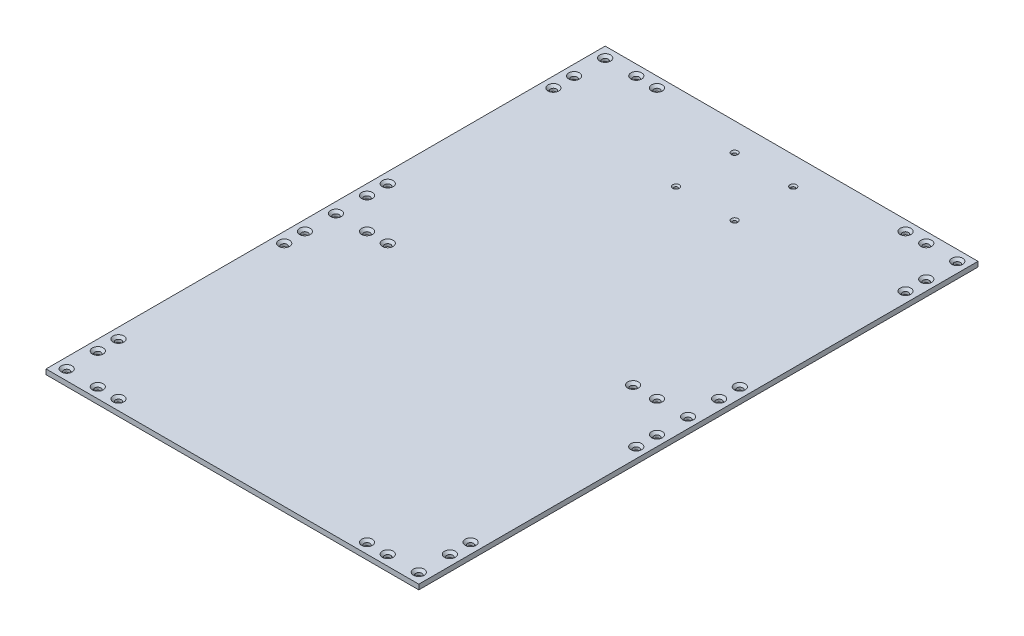
from build123d import *

# Parameters (mm, degrees)
SKETCH1_W                                       = 360
SKETCH1_H                                       = 540
BOSS_EXTRUDE1_DEPTH                             = 4.826
CSK_FOR_M3_FLAT_HEAD_MACHINE_SCREW1_D           = 3.6
CSK_FOR_M3_FLAT_HEAD_MACHINE_SCREW1_CSINK_D     = 6.3
CSK_FOR_M3_FLAT_HEAD_MACHINE_SCREW1_CSINK_ANGLE = 90
CSK_FOR_M5_FLAT_HEAD_MACHINE_SCREW1_AT_2_COUNT  = 2
CSK_FOR_M5_FLAT_HEAD_MACHINE_SCREW1_AT_2_PITCH  = 231.948270095
CSK_FOR_M5_FLAT_HEAD_MACHINE_SCREW1_AT_3_COUNT  = 2
CSK_FOR_M5_FLAT_HEAD_MACHINE_SCREW1_AT_3_PITCH  = 230
CSK_FOR_M5_FLAT_HEAD_MACHINE_SCREW1_AT_4_COUNT  = 2
CSK_FOR_M5_FLAT_HEAD_MACHINE_SCREW1_AT_4_PITCH  = 280
CSK_FOR_M5_FLAT_HEAD_MACHINE_SCREW1_AT_5_COUNT  = 2
CSK_FOR_M5_FLAT_HEAD_MACHINE_SCREW1_AT_5_PITCH  = 42.426406871
CSK_FOR_M5_FLAT_HEAD_MACHINE_SCREW1_AT_6_COUNT  = 2
CSK_FOR_M5_FLAT_HEAD_MACHINE_SCREW1_AT_6_PITCH  = 30
CSK_FOR_M5_FLAT_HEAD_MACHINE_SCREW1_AT_7_COUNT  = 2
CSK_FOR_M5_FLAT_HEAD_MACHINE_SCREW1_AT_7_PITCH  = 311.448230048
CSK_FOR_M5_FLAT_HEAD_MACHINE_SCREW1_AT_8_COUNT  = 2
CSK_FOR_M5_FLAT_HEAD_MACHINE_SCREW1_AT_8_PITCH  = 341.320963318
CSK_FOR_M5_FLAT_HEAD_MACHINE_SCREW1_AT_9_COUNT  = 2
CSK_FOR_M5_FLAT_HEAD_MACHINE_SCREW1_AT_9_PITCH  = 340
CSK_FOR_M5_FLAT_HEAD_MACHINE_SCREW1_AT_1_COUNT  = 2
CSK_FOR_M5_FLAT_HEAD_MACHINE_SCREW1_AT_1_PITCH  = 200
CSK_FOR_M5_FLAT_HEAD_MACHINE_SCREW1_2_COUNT     = 2
CSK_FOR_M5_FLAT_HEAD_MACHINE_SCREW1_2_PITCH     = 410.487515035
CSK_FOR_M5_FLAT_HEAD_MACHINE_SCREW1_3_COUNT     = 2
CSK_FOR_M5_FLAT_HEAD_MACHINE_SCREW1_3_PITCH     = 260
CSK_FOR_M5_FLAT_HEAD_MACHINE_SCREW1_4_COUNT     = 2
CSK_FOR_M5_FLAT_HEAD_MACHINE_SCREW1_4_PITCH     = 386.005181312
CSK_FOR_M5_FLAT_HEAD_MACHINE_SCREW1_5_COUNT     = 2
CSK_FOR_M5_FLAT_HEAD_MACHINE_SCREW1_5_PITCH     = 572.013985843
CSK_FOR_M5_FLAT_HEAD_MACHINE_SCREW1_6_COUNT     = 2
CSK_FOR_M5_FLAT_HEAD_MACHINE_SCREW1_6_PITCH     = 596.40590205
CSK_FOR_M5_FLAT_HEAD_MACHINE_SCREW1_7_COUNT     = 2
CSK_FOR_M5_FLAT_HEAD_MACHINE_SCREW1_7_PITCH     = 579.827560573
CSK_FOR_M5_FLAT_HEAD_MACHINE_SCREW1_8_COUNT     = 2
CSK_FOR_M5_FLAT_HEAD_MACHINE_SCREW1_8_PITCH     = 490.917508345
CSK_FOR_M5_FLAT_HEAD_MACHINE_SCREW1_9_COUNT     = 2
CSK_FOR_M5_FLAT_HEAD_MACHINE_SCREW1_9_PITCH     = 490
CSK_FOR_M5_FLAT_HEAD_MACHINE_SCREW1_10_COUNT    = 2
CSK_FOR_M5_FLAT_HEAD_MACHINE_SCREW1_10_PITCH    = 460
CSK_FOR_M5_FLAT_HEAD_MACHINE_SCREW1_11_COUNT    = 2
CSK_FOR_M5_FLAT_HEAD_MACHINE_SCREW1_11_PITCH    = 235.372045919
CSK_FOR_M5_FLAT_HEAD_MACHINE_SCREW1_12_COUNT    = 2
CSK_FOR_M5_FLAT_HEAD_MACHINE_SCREW1_12_PITCH    = 180
CSK_FOR_M5_FLAT_HEAD_MACHINE_SCREW1_13_COUNT    = 2
CSK_FOR_M5_FLAT_HEAD_MACHINE_SCREW1_13_PITCH    = 440
CSK_FOR_M5_FLAT_HEAD_MACHINE_SCREW1_14_COUNT    = 2
CSK_FOR_M5_FLAT_HEAD_MACHINE_SCREW1_14_PITCH    = 492.544414241
CSK_FOR_M5_FLAT_HEAD_MACHINE_SCREW1_15_COUNT    = 2
CSK_FOR_M5_FLAT_HEAD_MACHINE_SCREW1_15_PITCH    = 569.385633819
CSK_FOR_M5_FLAT_HEAD_MACHINE_SCREW1_16_COUNT    = 2
CSK_FOR_M5_FLAT_HEAD_MACHINE_SCREW1_16_PITCH    = 556.057550978
CSK_FOR_M5_FLAT_HEAD_MACHINE_SCREW1_17_COUNT    = 2
CSK_FOR_M5_FLAT_HEAD_MACHINE_SCREW1_17_PITCH    = 440.454310911
CSK_FOR_M5_FLAT_HEAD_MACHINE_SCREW1_18_COUNT    = 2
CSK_FOR_M5_FLAT_HEAD_MACHINE_SCREW1_18_PITCH    = 428.018691181
CSK_FOR_M5_FLAT_HEAD_MACHINE_SCREW1_19_COUNT    = 2
CSK_FOR_M5_FLAT_HEAD_MACHINE_SCREW1_19_PITCH    = 367.730729503
CSK_FOR_M5_FLAT_HEAD_MACHINE_SCREW1_20_COUNT    = 2
CSK_FOR_M5_FLAT_HEAD_MACHINE_SCREW1_20_PITCH    = 394.461658466
CSK_FOR_M5_FLAT_HEAD_MACHINE_SCREW1_21_COUNT    = 2
CSK_FOR_M5_FLAT_HEAD_MACHINE_SCREW1_21_PITCH    = 384.707681233
CSK_FOR_M5_FLAT_HEAD_MACHINE_SCREW1_22_COUNT    = 2
CSK_FOR_M5_FLAT_HEAD_MACHINE_SCREW1_22_PITCH    = 340.587727319
CSK_FOR_M5_FLAT_HEAD_MACHINE_SCREW1_23_COUNT    = 2
CSK_FOR_M5_FLAT_HEAD_MACHINE_SCREW1_23_PITCH    = 291.547594742
CSK_FOR_M5_FLAT_HEAD_MACHINE_SCREW1_24_COUNT    = 2
CSK_FOR_M5_FLAT_HEAD_MACHINE_SCREW1_24_PITCH    = 20
CSK_FOR_M5_FLAT_HEAD_MACHINE_SCREW1_25_COUNT    = 2
CSK_FOR_M5_FLAT_HEAD_MACHINE_SCREW1_25_PITCH    = 58.309518948


with BuildPart() as part:
    # Sketch1 → Boss-Extrude1 (new body)
    with BuildSketch(Plane(origin=(0, 0, 0), x_dir=(1, 0, 0), z_dir=(0, 1, 0))):
        with Locations((180, -270)):
            Rectangle(SKETCH1_W, SKETCH1_H)
    extrude(amount=BOSS_EXTRUDE1_DEPTH)

    # CSK for M3 Flat Head Machine Screw1 (through all)
    with Locations(Plane(origin=(0, 4.826, 0), x_dir=(1, 0, 0), z_dir=(0, 1, 0))):
        with Locations((151.715728753, -26.715728753), (208.284271247, -26.715728753), (208.284271247, -83.284271247), (151.715728753, -83.284271247)):
            CounterSinkHole(CSK_FOR_M3_FLAT_HEAD_MACHINE_SCREW1_D / 2, CSK_FOR_M3_FLAT_HEAD_MACHINE_SCREW1_CSINK_D / 2, counter_sink_angle=CSK_FOR_M3_FLAT_HEAD_MACHINE_SCREW1_CSINK_ANGLE)

    # Sketch15 → CSK for M5 Flat Head Machine Screw1 (revolve, cut)
    with BuildSketch(Plane(origin=(10, 4.826, 500), x_dir=(0, 0, 1), z_dir=(1, 0, 0))):
        Polygon((0, 0), (0, 4.826), (2.9, 4.826), (2.9, 2.3), (5.2, 0), align=None)
    csk_for_m5_flat_head_machine_screw1 = revolve(axis=Axis((10, 11.176, 500), (0, -1, 0)), mode=Mode.SUBTRACT)

    # CSK for M5 Flat Head Machine Screw1 at 2: CSK for M5 Flat Head Machine Screw1 ×2
    with Locations(*[Vector(0.12933918406776812, 0, -0.9916004111862218) * (i * CSK_FOR_M5_FLAT_HEAD_MACHINE_SCREW1_AT_2_PITCH) for i in range(1, CSK_FOR_M5_FLAT_HEAD_MACHINE_SCREW1_AT_2_COUNT)]):
        add(csk_for_m5_flat_head_machine_screw1, mode=Mode.SUBTRACT)

    # CSK for M5 Flat Head Machine Screw1 at 3: CSK for M5 Flat Head Machine Screw1 ×2
    with Locations(*[(0, 0, -i * CSK_FOR_M5_FLAT_HEAD_MACHINE_SCREW1_AT_3_PITCH) for i in range(1, CSK_FOR_M5_FLAT_HEAD_MACHINE_SCREW1_AT_3_COUNT)]):
        add(csk_for_m5_flat_head_machine_screw1, mode=Mode.SUBTRACT)

    # CSK for M5 Flat Head Machine Screw1 at 4: CSK for M5 Flat Head Machine Screw1 ×2
    with Locations(*[(0, 0, -i * CSK_FOR_M5_FLAT_HEAD_MACHINE_SCREW1_AT_4_PITCH) for i in range(1, CSK_FOR_M5_FLAT_HEAD_MACHINE_SCREW1_AT_4_COUNT)]):
        add(csk_for_m5_flat_head_machine_screw1, mode=Mode.SUBTRACT)

    # CSK for M5 Flat Head Machine Screw1 at 5: CSK for M5 Flat Head Machine Screw1 ×2
    with Locations(*[Vector(0.7071067811865471, 0, 0.707106781186548) * (i * CSK_FOR_M5_FLAT_HEAD_MACHINE_SCREW1_AT_5_PITCH) for i in range(1, CSK_FOR_M5_FLAT_HEAD_MACHINE_SCREW1_AT_5_COUNT)]):
        add(csk_for_m5_flat_head_machine_screw1, mode=Mode.SUBTRACT)

    # CSK for M5 Flat Head Machine Screw1 at 6: CSK for M5 Flat Head Machine Screw1 ×2
    with Locations(*[(0, 0, i * CSK_FOR_M5_FLAT_HEAD_MACHINE_SCREW1_AT_6_PITCH) for i in range(1, CSK_FOR_M5_FLAT_HEAD_MACHINE_SCREW1_AT_6_COUNT)]):
        add(csk_for_m5_flat_head_machine_screw1, mode=Mode.SUBTRACT)

    # CSK for M5 Flat Head Machine Screw1 at 7: CSK for M5 Flat Head Machine Screw1 ×2
    with Locations(*[Vector(0.9953500135553002, 0, 0.09632419486019031) * (i * CSK_FOR_M5_FLAT_HEAD_MACHINE_SCREW1_AT_7_PITCH) for i in range(1, CSK_FOR_M5_FLAT_HEAD_MACHINE_SCREW1_AT_7_COUNT)]):
        add(csk_for_m5_flat_head_machine_screw1, mode=Mode.SUBTRACT)

    # CSK for M5 Flat Head Machine Screw1 at 8: CSK for M5 Flat Head Machine Screw1 ×2
    with Locations(*[Vector(0.996129850025381, 0, 0.08789381029635711) * (i * CSK_FOR_M5_FLAT_HEAD_MACHINE_SCREW1_AT_8_PITCH) for i in range(1, CSK_FOR_M5_FLAT_HEAD_MACHINE_SCREW1_AT_8_COUNT)]):
        add(csk_for_m5_flat_head_machine_screw1, mode=Mode.SUBTRACT)

    # CSK for M5 Flat Head Machine Screw1 at 9: CSK for M5 Flat Head Machine Screw1 ×2
    with Locations(*[(i * CSK_FOR_M5_FLAT_HEAD_MACHINE_SCREW1_AT_9_PITCH, 0, 0) for i in range(1, CSK_FOR_M5_FLAT_HEAD_MACHINE_SCREW1_AT_9_COUNT)]):
        add(csk_for_m5_flat_head_machine_screw1, mode=Mode.SUBTRACT)

    # CSK for M5 Flat Head Machine Screw1 at 1: CSK for M5 Flat Head Machine Screw1 ×2
    with Locations(*[(0, 0, -i * CSK_FOR_M5_FLAT_HEAD_MACHINE_SCREW1_AT_1_PITCH) for i in range(1, CSK_FOR_M5_FLAT_HEAD_MACHINE_SCREW1_AT_1_COUNT)]):
        add(csk_for_m5_flat_head_machine_screw1, mode=Mode.SUBTRACT)

    # CSK for M5 Flat Head Machine Screw1  2: CSK for M5 Flat Head Machine Screw1 ×2
    with Locations(*[Vector(0.828283413127963, 0, -0.5603093677042105) * (i * CSK_FOR_M5_FLAT_HEAD_MACHINE_SCREW1_2_PITCH) for i in range(1, CSK_FOR_M5_FLAT_HEAD_MACHINE_SCREW1_2_COUNT)]):
        add(csk_for_m5_flat_head_machine_screw1, mode=Mode.SUBTRACT)

    # CSK for M5 Flat Head Machine Screw1  3: CSK for M5 Flat Head Machine Screw1 ×2
    with Locations(*[(0, 0, -i * CSK_FOR_M5_FLAT_HEAD_MACHINE_SCREW1_3_PITCH) for i in range(1, CSK_FOR_M5_FLAT_HEAD_MACHINE_SCREW1_3_COUNT)]):
        add(csk_for_m5_flat_head_machine_screw1, mode=Mode.SUBTRACT)

    # CSK for M5 Flat Head Machine Screw1  4: CSK for M5 Flat Head Machine Screw1 ×2
    with Locations(*[Vector(0.8030980282338016, 0, -0.5958469241734659) * (i * CSK_FOR_M5_FLAT_HEAD_MACHINE_SCREW1_4_PITCH) for i in range(1, CSK_FOR_M5_FLAT_HEAD_MACHINE_SCREW1_4_COUNT)]):
        add(csk_for_m5_flat_head_machine_screw1, mode=Mode.SUBTRACT)

    # CSK for M5 Flat Head Machine Screw1  5: CSK for M5 Flat Head Machine Screw1 ×2
    with Locations(*[Vector(0.5943910610838058, 0, -0.8041761414663255) * (i * CSK_FOR_M5_FLAT_HEAD_MACHINE_SCREW1_5_PITCH) for i in range(1, CSK_FOR_M5_FLAT_HEAD_MACHINE_SCREW1_5_COUNT)]):
        add(csk_for_m5_flat_head_machine_screw1, mode=Mode.SUBTRACT)

    # CSK for M5 Flat Head Machine Screw1  6: CSK for M5 Flat Head Machine Screw1 ×2
    with Locations(*[Vector(0.5700815482062942, 0, -0.821588113591424) * (i * CSK_FOR_M5_FLAT_HEAD_MACHINE_SCREW1_6_PITCH) for i in range(1, CSK_FOR_M5_FLAT_HEAD_MACHINE_SCREW1_6_COUNT)]):
        add(csk_for_m5_flat_head_machine_screw1, mode=Mode.SUBTRACT)

    # CSK for M5 Flat Head Machine Screw1  7: CSK for M5 Flat Head Machine Screw1 ×2
    with Locations(*[Vector(0.5346417126044627, 0, -0.8450788360522155) * (i * CSK_FOR_M5_FLAT_HEAD_MACHINE_SCREW1_7_PITCH) for i in range(1, CSK_FOR_M5_FLAT_HEAD_MACHINE_SCREW1_7_COUNT)]):
        add(csk_for_m5_flat_head_machine_screw1, mode=Mode.SUBTRACT)

    # CSK for M5 Flat Head Machine Screw1  8: CSK for M5 Flat Head Machine Screw1 ×2
    with Locations(*[Vector(0.06111006327950326, 0, -0.9981310335652204) * (i * CSK_FOR_M5_FLAT_HEAD_MACHINE_SCREW1_8_PITCH) for i in range(1, CSK_FOR_M5_FLAT_HEAD_MACHINE_SCREW1_8_COUNT)]):
        add(csk_for_m5_flat_head_machine_screw1, mode=Mode.SUBTRACT)

    # CSK for M5 Flat Head Machine Screw1  9: CSK for M5 Flat Head Machine Screw1 ×2
    with Locations(*[(0, 0, -i * CSK_FOR_M5_FLAT_HEAD_MACHINE_SCREW1_9_PITCH) for i in range(1, CSK_FOR_M5_FLAT_HEAD_MACHINE_SCREW1_9_COUNT)]):
        add(csk_for_m5_flat_head_machine_screw1, mode=Mode.SUBTRACT)

    # CSK for M5 Flat Head Machine Screw1  10: CSK for M5 Flat Head Machine Screw1 ×2
    with Locations(*[(0, 0, -i * CSK_FOR_M5_FLAT_HEAD_MACHINE_SCREW1_10_PITCH) for i in range(1, CSK_FOR_M5_FLAT_HEAD_MACHINE_SCREW1_10_COUNT)]):
        add(csk_for_m5_flat_head_machine_screw1, mode=Mode.SUBTRACT)

    # CSK for M5 Flat Head Machine Screw1  11: CSK for M5 Flat Head Machine Screw1 ×2
    with Locations(*[Vector(0.21242964433104353, 0, -0.977176363922801) * (i * CSK_FOR_M5_FLAT_HEAD_MACHINE_SCREW1_11_PITCH) for i in range(1, CSK_FOR_M5_FLAT_HEAD_MACHINE_SCREW1_11_COUNT)]):
        add(csk_for_m5_flat_head_machine_screw1, mode=Mode.SUBTRACT)

    # CSK for M5 Flat Head Machine Screw1  12: CSK for M5 Flat Head Machine Screw1 ×2
    with Locations(*[(0, 0, -i * CSK_FOR_M5_FLAT_HEAD_MACHINE_SCREW1_12_PITCH) for i in range(1, CSK_FOR_M5_FLAT_HEAD_MACHINE_SCREW1_12_COUNT)]):
        add(csk_for_m5_flat_head_machine_screw1, mode=Mode.SUBTRACT)

    # CSK for M5 Flat Head Machine Screw1  13: CSK for M5 Flat Head Machine Screw1 ×2
    with Locations(*[(0, 0, -i * CSK_FOR_M5_FLAT_HEAD_MACHINE_SCREW1_13_PITCH) for i in range(1, CSK_FOR_M5_FLAT_HEAD_MACHINE_SCREW1_13_COUNT)]):
        add(csk_for_m5_flat_head_machine_screw1, mode=Mode.SUBTRACT)

    # CSK for M5 Flat Head Machine Screw1  14: CSK for M5 Flat Head Machine Screw1 ×2
    with Locations(*[Vector(0.10151368801339447, 0, -0.994834142531266) * (i * CSK_FOR_M5_FLAT_HEAD_MACHINE_SCREW1_14_PITCH) for i in range(1, CSK_FOR_M5_FLAT_HEAD_MACHINE_SCREW1_14_COUNT)]):
        add(csk_for_m5_flat_head_machine_screw1, mode=Mode.SUBTRACT)

    # CSK for M5 Flat Head Machine Screw1  15: CSK for M5 Flat Head Machine Screw1 ×2
    with Locations(*[Vector(0.5093208939162445, 0, -0.860576682823999) * (i * CSK_FOR_M5_FLAT_HEAD_MACHINE_SCREW1_15_PITCH) for i in range(1, CSK_FOR_M5_FLAT_HEAD_MACHINE_SCREW1_15_COUNT)]):
        add(csk_for_m5_flat_head_machine_screw1, mode=Mode.SUBTRACT)

    # CSK for M5 Flat Head Machine Screw1  16: CSK for M5 Flat Head Machine Screw1 ×2
    with Locations(*[Vector(0.6114475010757656, 0, -0.7912850013921671) * (i * CSK_FOR_M5_FLAT_HEAD_MACHINE_SCREW1_16_PITCH) for i in range(1, CSK_FOR_M5_FLAT_HEAD_MACHINE_SCREW1_16_COUNT)]):
        add(csk_for_m5_flat_head_machine_screw1, mode=Mode.SUBTRACT)

    # CSK for M5 Flat Head Machine Screw1  17: CSK for M5 Flat Head Machine Screw1 ×2
    with Locations(*[Vector(0.7719302356170498, 0, -0.6357072528610996) * (i * CSK_FOR_M5_FLAT_HEAD_MACHINE_SCREW1_17_PITCH) for i in range(1, CSK_FOR_M5_FLAT_HEAD_MACHINE_SCREW1_17_COUNT)]):
        add(csk_for_m5_flat_head_machine_screw1, mode=Mode.SUBTRACT)

    # CSK for M5 Flat Head Machine Screw1  18: CSK for M5 Flat Head Machine Screw1 ×2
    with Locations(*[Vector(0.7943578329771963, 0, -0.607450107570797) * (i * CSK_FOR_M5_FLAT_HEAD_MACHINE_SCREW1_18_PITCH) for i in range(1, CSK_FOR_M5_FLAT_HEAD_MACHINE_SCREW1_18_COUNT)]):
        add(csk_for_m5_flat_head_machine_screw1, mode=Mode.SUBTRACT)

    # CSK for M5 Flat Head Machine Screw1  19: CSK for M5 Flat Head Machine Screw1 ×2
    with Locations(*[Vector(0.7802581117415023, 0, -0.6254576556902838) * (i * CSK_FOR_M5_FLAT_HEAD_MACHINE_SCREW1_19_PITCH) for i in range(1, CSK_FOR_M5_FLAT_HEAD_MACHINE_SCREW1_19_COUNT)]):
        add(csk_for_m5_flat_head_machine_screw1, mode=Mode.SUBTRACT)

    # CSK for M5 Flat Head Machine Screw1  20: CSK for M5 Flat Head Machine Screw1 ×2
    with Locations(*[Vector(0.8619342151577696, 0, -0.5070201265633937) * (i * CSK_FOR_M5_FLAT_HEAD_MACHINE_SCREW1_20_PITCH) for i in range(1, CSK_FOR_M5_FLAT_HEAD_MACHINE_SCREW1_20_COUNT)]):
        add(csk_for_m5_flat_head_machine_screw1, mode=Mode.SUBTRACT)

    # CSK for M5 Flat Head Machine Screw1  21: CSK for M5 Flat Head Machine Screw1 ×2
    with Locations(*[Vector(0.8837879163470619, 0, -0.46788772041903254) * (i * CSK_FOR_M5_FLAT_HEAD_MACHINE_SCREW1_21_PITCH) for i in range(1, CSK_FOR_M5_FLAT_HEAD_MACHINE_SCREW1_21_COUNT)]):
        add(csk_for_m5_flat_head_machine_screw1, mode=Mode.SUBTRACT)

    # CSK for M5 Flat Head Machine Screw1  22: CSK for M5 Flat Head Machine Screw1 ×2
    with Locations(*[Vector(0.9982743731749959, 0, -0.058722021951470325) * (i * CSK_FOR_M5_FLAT_HEAD_MACHINE_SCREW1_22_PITCH) for i in range(1, CSK_FOR_M5_FLAT_HEAD_MACHINE_SCREW1_22_COUNT)]):
        add(csk_for_m5_flat_head_machine_screw1, mode=Mode.SUBTRACT)

    # CSK for M5 Flat Head Machine Screw1  23: CSK for M5 Flat Head Machine Screw1 ×2
    with Locations(*[Vector(0.9946917938265513, 0, 0.10289915108550526) * (i * CSK_FOR_M5_FLAT_HEAD_MACHINE_SCREW1_23_PITCH) for i in range(1, CSK_FOR_M5_FLAT_HEAD_MACHINE_SCREW1_23_COUNT)]):
        add(csk_for_m5_flat_head_machine_screw1, mode=Mode.SUBTRACT)

    # CSK for M5 Flat Head Machine Screw1  24: CSK for M5 Flat Head Machine Screw1 ×2
    with Locations(*[(0, 0, -i * CSK_FOR_M5_FLAT_HEAD_MACHINE_SCREW1_24_PITCH) for i in range(1, CSK_FOR_M5_FLAT_HEAD_MACHINE_SCREW1_24_COUNT)]):
        add(csk_for_m5_flat_head_machine_screw1, mode=Mode.SUBTRACT)

    # CSK for M5 Flat Head Machine Screw1  25: CSK for M5 Flat Head Machine Screw1 ×2
    with Locations(*[Vector(0.8574929257125441, 0, 0.5144957554275269) * (i * CSK_FOR_M5_FLAT_HEAD_MACHINE_SCREW1_25_PITCH) for i in range(1, CSK_FOR_M5_FLAT_HEAD_MACHINE_SCREW1_25_COUNT)]):
        add(csk_for_m5_flat_head_machine_screw1, mode=Mode.SUBTRACT)


solid = part.part
